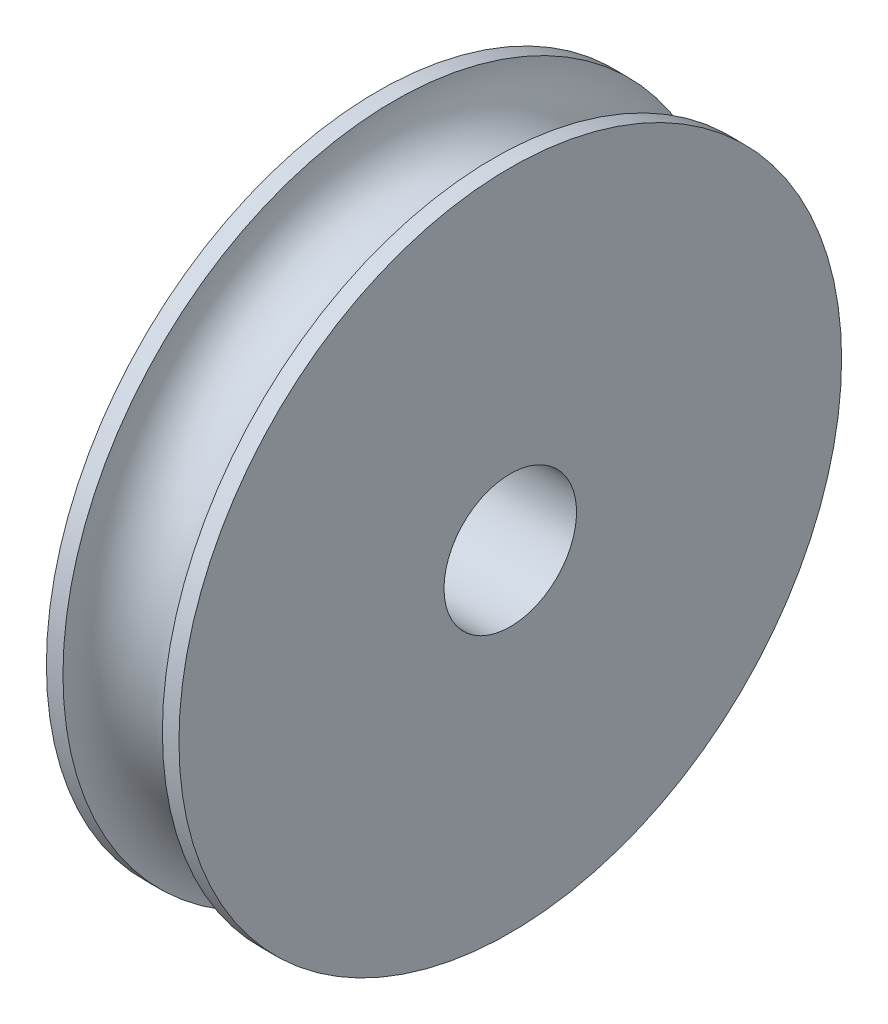
from build123d import *

# Parameters (mm, degrees)
SKETCH2_R          = 4
CUT_EXTRUDE1_DEPTH = 10


with BuildPart() as part:
    # Sketch1 → Revolve1 (revolve)
    with BuildSketch(Plane.XY, mode=Mode.PRIVATE) as revolve1_sk:
        with BuildLine():
            Line((0, 0), (0, 20))
            Line((0, 20), (1, 20))
            ThreePointArc((1, 20), (4, 17), (7, 20))
            Line((7, 20), (8, 20))
            Line((8, 20), (8, 0))
            Line((8, 0), (0, 0))
        make_face()
    revolve(revolve1_sk.sketch.rotate(Axis((0, 0, 0), (1, 0, 0)), 90), axis=Axis((0, 0, 0), (1, 0, 0)))

    # Sketch2 → Cut-Extrude1 (cut)
    with BuildSketch(Plane.ZY):
        Circle(SKETCH2_R)
    extrude(amount=-CUT_EXTRUDE1_DEPTH, mode=Mode.SUBTRACT)


solid = part.part
